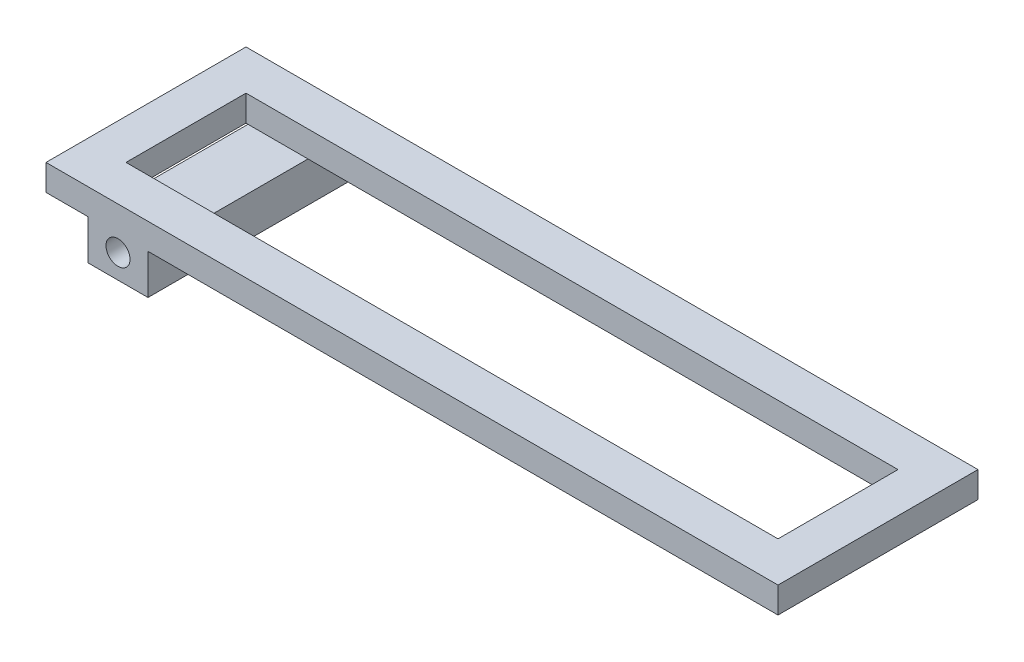
from build123d import *

# Parameters (mm, degrees)
SKETCH_1_W          = 183
SKETCH_1_H          = 6.5
EXTRUDE_1_DEPTH     = 10
SKETCH_2_W          = 10
SKETCH_2_H          = 6.5
EXTRUDE_2_DEPTH     = 40
EXTRUDE_3_REACH     = 182.198
SKETCH_3_W          = 10
SKETCH_3_H          = 6.5
SKETCH_7_W          = 15
SKETCH_7_H          = 50
EXTRUDE_5_DEPTH     = 10
CUT_EXTRUDE_2_REACH = 191.971
SKETCH_8_R          = 3


with BuildPart() as part:
    # 草图1 → 凸台-拉伸1 (new body)
    with BuildSketch(Plane.XY):
        with Locations((91.5, 3.25)):
            Rectangle(SKETCH_1_W, SKETCH_1_H)
    extrude(amount=-EXTRUDE_1_DEPTH)

    # 草图2 → 凸台-拉伸2 (add)
    with BuildSketch(Plane(origin=(0, 0, -10), x_dir=(-1, 0, 0), z_dir=(0, 0, -1))):
        with Locations((-178, 3.25)):
            Rectangle(SKETCH_2_W, SKETCH_2_H)
        with Locations((-5, 3.25)):
            Rectangle(SKETCH_2_W, SKETCH_2_H)
    extrude(amount=EXTRUDE_2_DEPTH)

    # 草图3 → 凸台-拉伸3 (add, up to next)
    with BuildSketch(Plane(origin=(10, 0, 0), x_dir=(0, 0, -1), z_dir=(1, 0, 0)), mode=Mode.PRIVATE) as extrude_3_sk1:
        with Locations((45, 3.25)):
            Rectangle(SKETCH_3_W, SKETCH_3_H)
    extrude_3_tool1 = extrude(extrude_3_sk1.sketch, amount=EXTRUDE_3_REACH, mode=Mode.PRIVATE) - part.part
    add(extrude_3_tool1.solids().sort_by_distance((10, 3.25, -45))[0])

    # 草图7 → 凸台-拉伸5 (add)
    with BuildSketch(Plane.XZ):
        with Locations((18, -25)):
            Rectangle(SKETCH_7_W, SKETCH_7_H)
    extrude(amount=EXTRUDE_5_DEPTH)

    # 草图8 → 切除-拉伸2 (cut, up to next)
    with BuildSketch(Plane.XY, mode=Mode.PRIVATE) as cut_extrude_2_sk1:
        with Locations((18, -4)):
            Circle(SKETCH_8_R)
    cut_extrude_2_tool1 = extrude(cut_extrude_2_sk1.sketch, amount=-CUT_EXTRUDE_2_REACH, mode=Mode.PRIVATE) & part.part
    add(cut_extrude_2_tool1.solids().sort_by_distance((18, -4, 0))[0], mode=Mode.SUBTRACT)


solid = part.part
